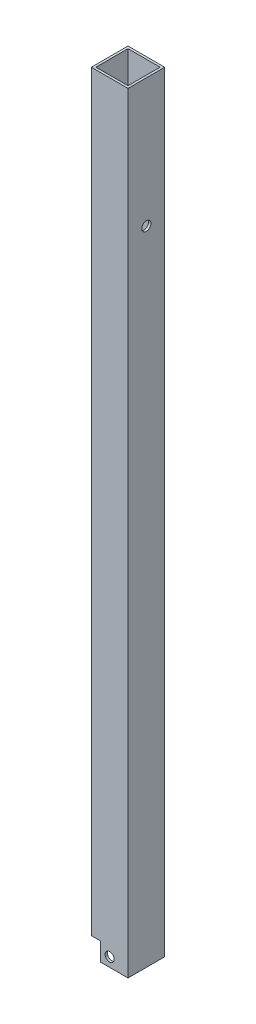
from build123d import *

# Parameters (mm, degrees)
SKETCH1_W           = 25.4
SKETCH1_H           = 25.4
SKETCH1_W_2         = 22.225
SKETCH1_H_2         = 22.225
BOSS_EXTRUDE1_DEPTH = 533.4
SKETCH2_W           = 6.35
SKETCH2_H           = 12.7
CUT_EXTRUDE1_DEPTH  = 25.4
SKETCH3_R           = 3.175
CUT_EXTRUDE2_DEPTH  = 25.4
SKETCH4_R           = 3.175
CUT_EXTRUDE3_DEPTH  = 25.4


with BuildPart() as part:
    # Sketch1 → Boss-Extrude1 (new body)
    with BuildSketch(Plane(origin=(0, 0, 0), x_dir=(1, 0, 0), z_dir=(0, 1, 0))):
        Rectangle(SKETCH1_W, SKETCH1_H)
        Rectangle(SKETCH1_W_2, SKETCH1_H_2, mode=Mode.SUBTRACT)
    extrude(amount=BOSS_EXTRUDE1_DEPTH)

    # Sketch2 → Cut-Extrude1 (cut)
    with BuildSketch(Plane.XY.offset(12.7)):
        with Locations((-9.525, 6.35)):
            Rectangle(SKETCH2_W, SKETCH2_H)
    extrude(amount=-CUT_EXTRUDE1_DEPTH, mode=Mode.SUBTRACT)

    # Sketch3 → Cut-Extrude2 (cut)
    with BuildSketch(Plane.XY.offset(12.7)):
        with Locations((0, 6.35)):
            Circle(SKETCH3_R)
    extrude(amount=-CUT_EXTRUDE2_DEPTH, mode=Mode.SUBTRACT)

    # Sketch4 → Cut-Extrude3 (cut)
    with BuildSketch(Plane(origin=(12.7, 0, 0), x_dir=(0, 0, -1), z_dir=(1, 0, 0))):
        with Locations((0, 444.5)):
            Circle(SKETCH4_R)
    extrude(amount=-CUT_EXTRUDE3_DEPTH, mode=Mode.SUBTRACT)


solid = part.part
